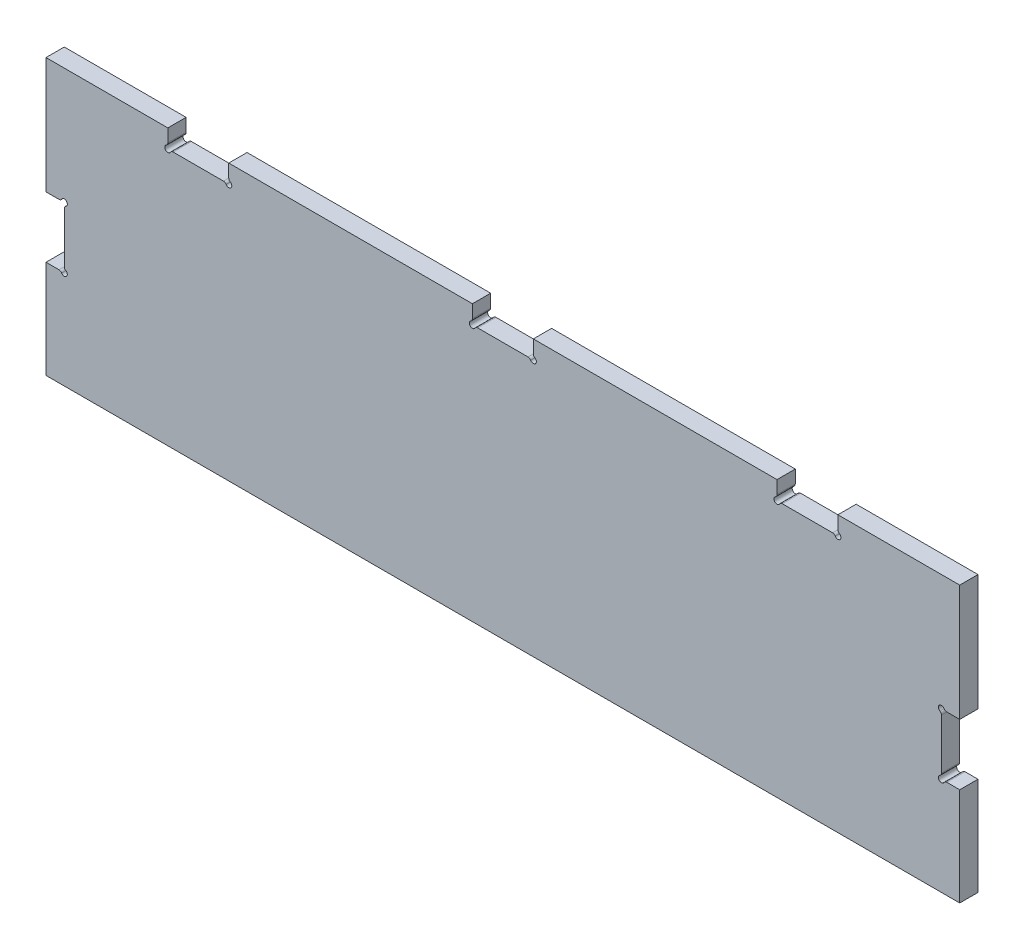
from build123d import *

# Parameters (mm, degrees)
BOSS_EXTRUDE1_DEPTH = 1.5
SKETCH2_R           = 0.5
CUT_EXTRUDE1_DEPTH  = 87.109465217
FILLET1_R           = 0.5


with BuildPart() as part:
    # Sketch1 → Boss-Extrude1 (new, symmetric)
    with BuildSketch(Plane.XY):
        Polygon((75, 3), (55, 3), (55, 0), (45, 0), (45, 3), (5, 3), (5, 0), (-5, 0), (-5, 3), (-45, 3), (-45, 0), (-55, 0), (-55, 3), (-75, 3), (-75, -16.1), (-72, -16.1), (-72, -26.1), (-75, -26.1), (-75, -42.2), (75, -42.2), (75, -26.1), (72, -26.1), (72, -16.1), (75, -16.1), align=None)
    extrude(amount=BOSS_EXTRUDE1_DEPTH, both=True)

    # Sketch2 → Cut-Extrude1 (cut, through all)
    with BuildSketch(Plane.XY.offset(1.5)):
        with Locations((-55, 0)):
            Circle(SKETCH2_R)
        with Locations((-45, 0)):
            Circle(SKETCH2_R)
        with Locations((-5, 0)):
            Circle(SKETCH2_R)
        with Locations((5, 0)):
            Circle(SKETCH2_R)
        with Locations((45, 0)):
            Circle(SKETCH2_R)
        with Locations((55, 0)):
            Circle(SKETCH2_R)
        with Locations((72, -16.1)):
            Circle(SKETCH2_R)
        with Locations((72, -26.1)):
            Circle(SKETCH2_R)
        with Locations((-72, -26.1)):
            Circle(SKETCH2_R)
        with Locations((-72, -16.1)):
            Circle(SKETCH2_R)
    extrude(amount=-CUT_EXTRUDE1_DEPTH, mode=Mode.SUBTRACT)

    # Fillet1
    fillet1_edges = [part.edges().sort_by_distance(p)[0] for p in [
        (-72, -25.6, 0),
        (-72.5, -26.1, 0),
        (72.5, -26.1, 0),
        (72, -25.6, 0),
        (72, -16.6, 0),
        (72.5, -16.1, 0),
        (55, 0.5, 0),
        (54.5, 0, 0),
        (45.5, 0, 0),
        (45, 0.5, 0),
        (5, 0.5, 0),
        (4.5, 0, 0),
        (-4.5, 0, 0),
        (-5, 0.5, 0),
        (-45, 0.5, 0),
        (-45.5, 0, 0),
        (-72.5, -16.1, 0),
        (-72, -16.6, 0),
        (-54.5, 0, 0),
        (-55, 0.5, 0),
    ]]
    fillet(fillet1_edges, radius=FILLET1_R)


solid = part.part
